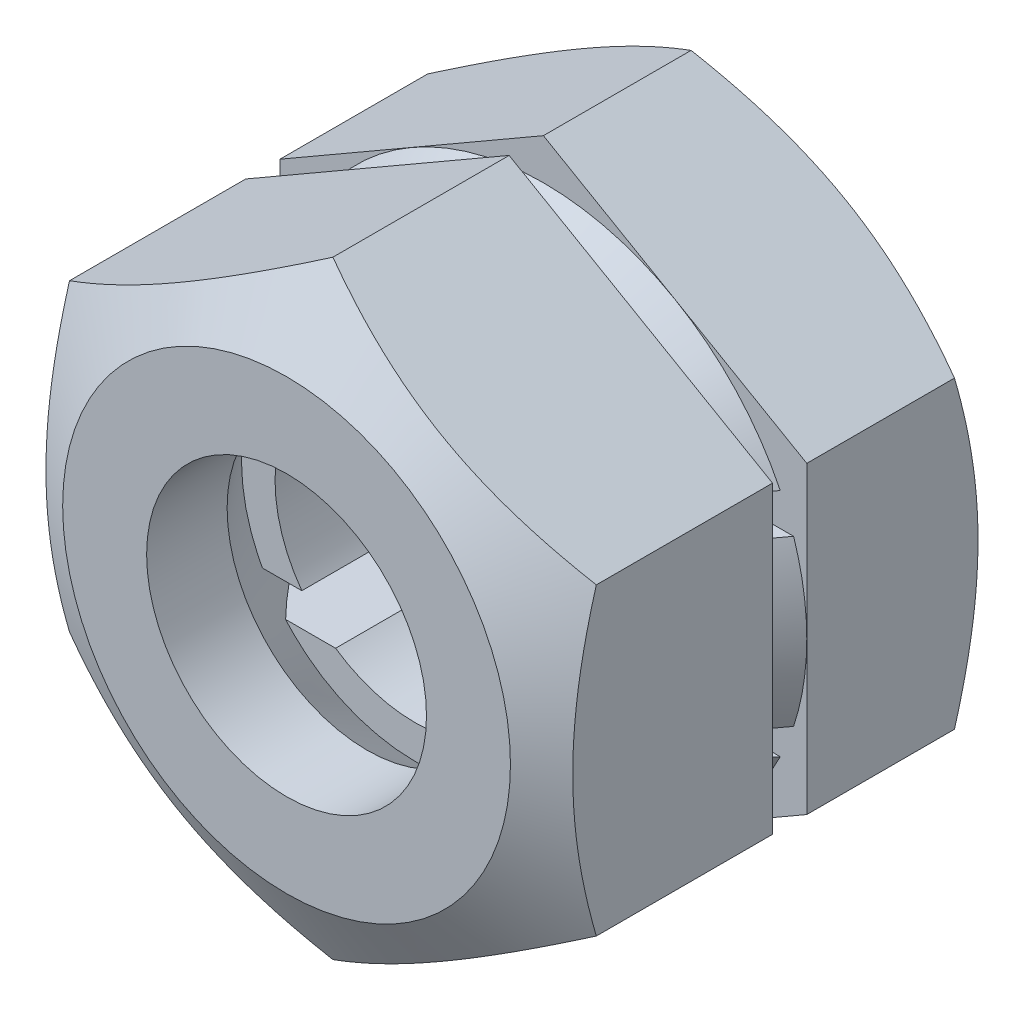
from build123d import *

# Parameters (mm, degrees)
VYSUNOUT1_DEPTH               = 5.2
SKICA2_R                      = 8
VYSUNOUT2_DEPTH               = 3.9
VYSUNOUT2_TAPER               = 35
VYSUNOUT3_DEPTH               = 6.76
SKICA4_R                      = 4.25
ODEBRAT_VYSUNUT_M1_DEPTH      = 18.841898255
ODEBRAT_VYSUNUT_M2_DEPTH      = 18.841898255
ODEBRAT_VYSUNUT_M2_DEPTH_BACK = 18.841898255
SKICA9_W                      = 3.9
SKICA9_H                      = 1


with BuildPart() as part:
    # Skica1 → Vysunout1 (new body)
    with BuildSketch(Plane.XY):
        Polygon((0, 9.237604307), (-8, 4.618802154), (-8, -4.618802154), (0, -9.237604307), (8, -4.618802154), (8, 4.618802154), align=None)
    extrude(amount=VYSUNOUT1_DEPTH)

    # Skica2 → Vysunout2 (add)
    with BuildSketch(Plane.XY.offset(5.2)):
        Circle(SKICA2_R)
    extrude(amount=VYSUNOUT2_DEPTH, taper=VYSUNOUT2_TAPER)


with BuildPart() as body_2:
    # Skica3 → Vysunout3 (new body)
    with BuildSketch(Plane.XY.offset(13)):
        Polygon((8, 4.618802154), (0, 9.237604307), (-8, 4.618802154), (-8, -4.618802154), (0, -9.237604307), (8, -4.618802154), align=None)
    extrude(amount=-VYSUNOUT3_DEPTH)


with BuildPart() as odebrat_vysunut_m1_tool:
    # Skica4 → Odebrat vysunutím1 (new, through all)
    with BuildSketch(Plane(origin=(0, 0, 0), x_dir=(-1, 0, 0), z_dir=(0, 0, -1))):
        Circle(SKICA4_R)
    extrude(amount=-ODEBRAT_VYSUNUT_M1_DEPTH)


with BuildPart() as part_1:
    add(part.part)

    # Odebrat vysunutím1: cut by odebrat_vysunut_m1_tool
    add(odebrat_vysunut_m1_tool.part, mode=Mode.SUBTRACT)

    # Skica8 → Odebrat rotací3 (revolve, cut)
    with BuildSketch(Plane(origin=(0, 0, 0), x_dir=(0, 0, -1), z_dir=(1, 0, 0))):
        Polygon((-0.71453118, 9.237604307), (0, 8), (0, 9.237604307), align=None)
    revolve(axis=Axis((0, 0, 0), (0, 0, 1)), mode=Mode.SUBTRACT)

    # Skica9 → Odebrat vysunutím2 (cut, two sides: drawn at the far end of the back side and taken through both)
    with BuildSketch(Plane(origin=(0, 0, 0), x_dir=(0, 0, -1), z_dir=(1, 0, 0)).offset(-ODEBRAT_VYSUNUT_M2_DEPTH_BACK)):
        with Locations((-7.15, 3)):
            Rectangle(SKICA9_W, SKICA9_H)
        with Locations((-7.15, -3)):
            Rectangle(SKICA9_W, SKICA9_H)
    extrude(amount=ODEBRAT_VYSUNUT_M2_DEPTH + ODEBRAT_VYSUNUT_M2_DEPTH_BACK, mode=Mode.SUBTRACT)


with BuildPart() as body_2_1:
    add(body_2.part)

    # Odebrat vysunutím1: cut by odebrat_vysunut_m1_tool
    add(odebrat_vysunut_m1_tool.part, mode=Mode.SUBTRACT)

    # Skica5 → Odebrat rotací1 (revolve, cut)
    with BuildSketch(Plane(origin=(0, 0, 0), x_dir=(1, 0, 0), z_dir=(0, 1, 0)), mode=Mode.PRIVATE) as odebrat_rotac_1_sk:
        Polygon((0, -6.24), (0, -10.555555025), (4.25, -10.555555025), (7.27178416, -6.24), align=None)
    revolve(odebrat_rotac_1_sk.sketch.rotate(Axis((0, 0, 0), (0, 0, 1)), 180), axis=Axis((0, 0, 0), (0, 0, 1)), mode=Mode.SUBTRACT)

    # Skica7 → Odebrat rotací2 (revolve, cut)
    with BuildSketch(Plane(origin=(0, 0, 0), x_dir=(0, 0, -1), z_dir=(1, 0, 0))):
        Polygon((-11.592648497, 9.237604307), (-13, 6.8), (-13, 9.237604307), align=None)
    revolve(axis=Axis((0, 0, 0), (0, 0, 1)), mode=Mode.SUBTRACT)


solid = Compound([part_1.part, body_2_1.part])
